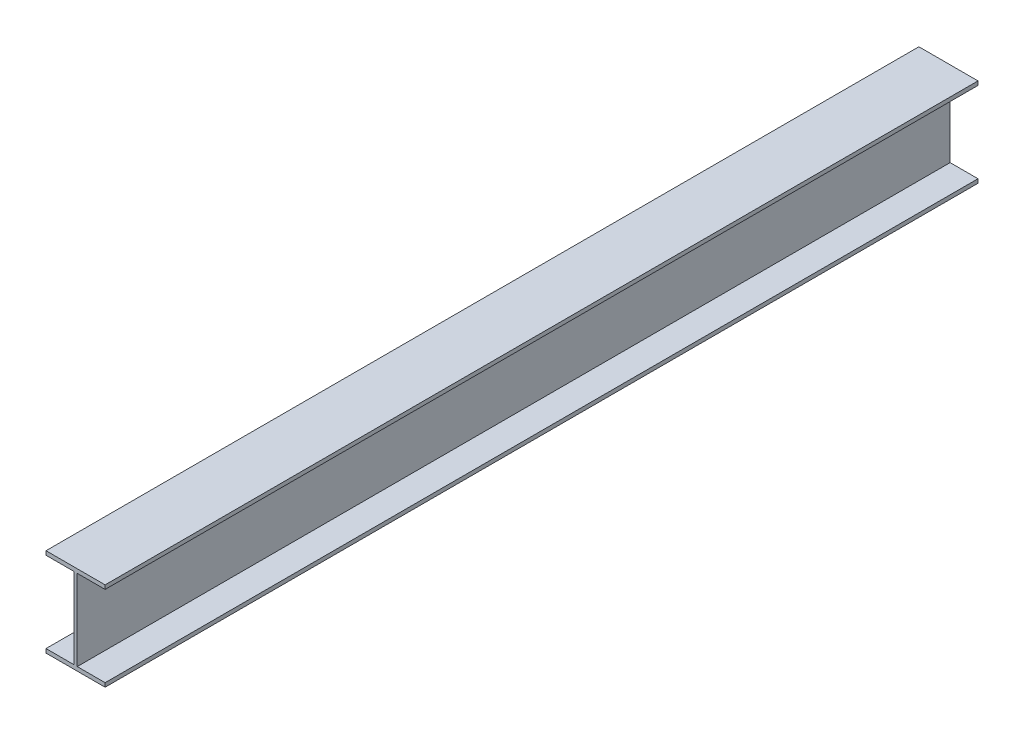
from build123d import *

# Parameters (mm, degrees)
SALIENTE_EXTRUIR1_DEPTH = 1500


with BuildPart() as part:
    # Croquis1 → Saliente-Extruir1 (new body)
    with BuildSketch(Plane.XY):
        Polygon((0, 0), (101.6, 0), (101.6, -6.8), (53.7, -6.8), (53.7, -145.6), (101.6, -145.6), (101.6, -152.4), (0, -152.4), (0, -145.6), (47.9, -145.6), (47.9, -6.8), (0, -6.8), align=None)
    extrude(amount=SALIENTE_EXTRUIR1_DEPTH)


solid = part.part
